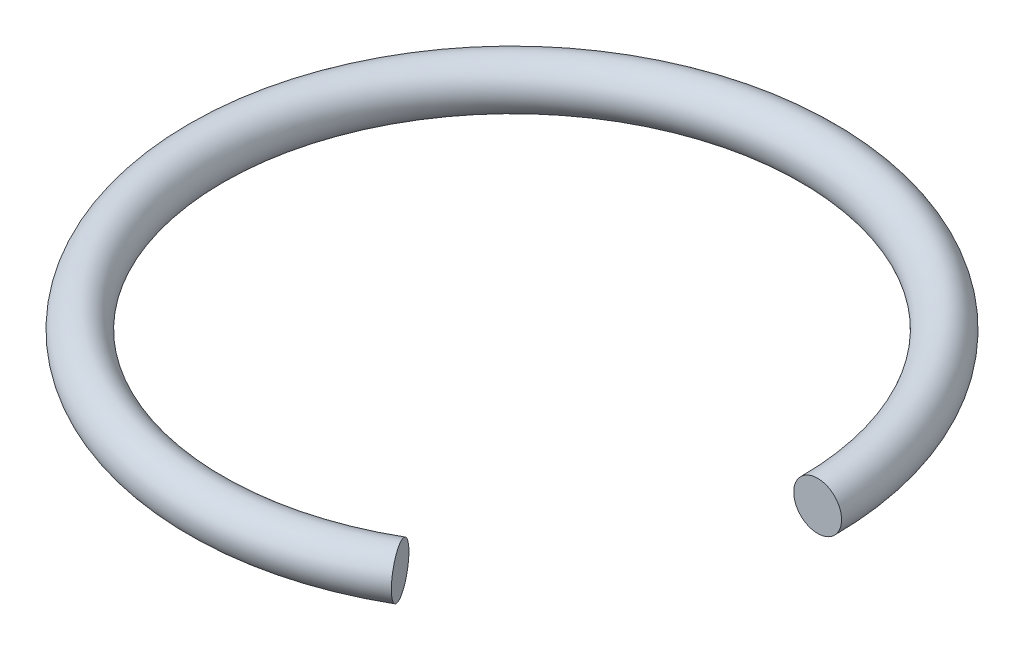
from build123d import *

# Parameters (mm, degrees)
RECONSTRUCTED_NOMINAL_AXIAL_PROFILE_R = 0.18
NATIVE_REVOLVED_GEOMETRY_ANGLE        = 300


with BuildPart() as part:
    # Reconstructed nominal axial profile → Native revolved geometry (revolve)
    with BuildSketch(Plane.XY):
        with Locations((2.3, 0)):
            Circle(RECONSTRUCTED_NOMINAL_AXIAL_PROFILE_R)
    revolve(axis=Axis((0, -500, 0), (0, 1, 0)), revolution_arc=NATIVE_REVOLVED_GEOMETRY_ANGLE)


solid = part.part
